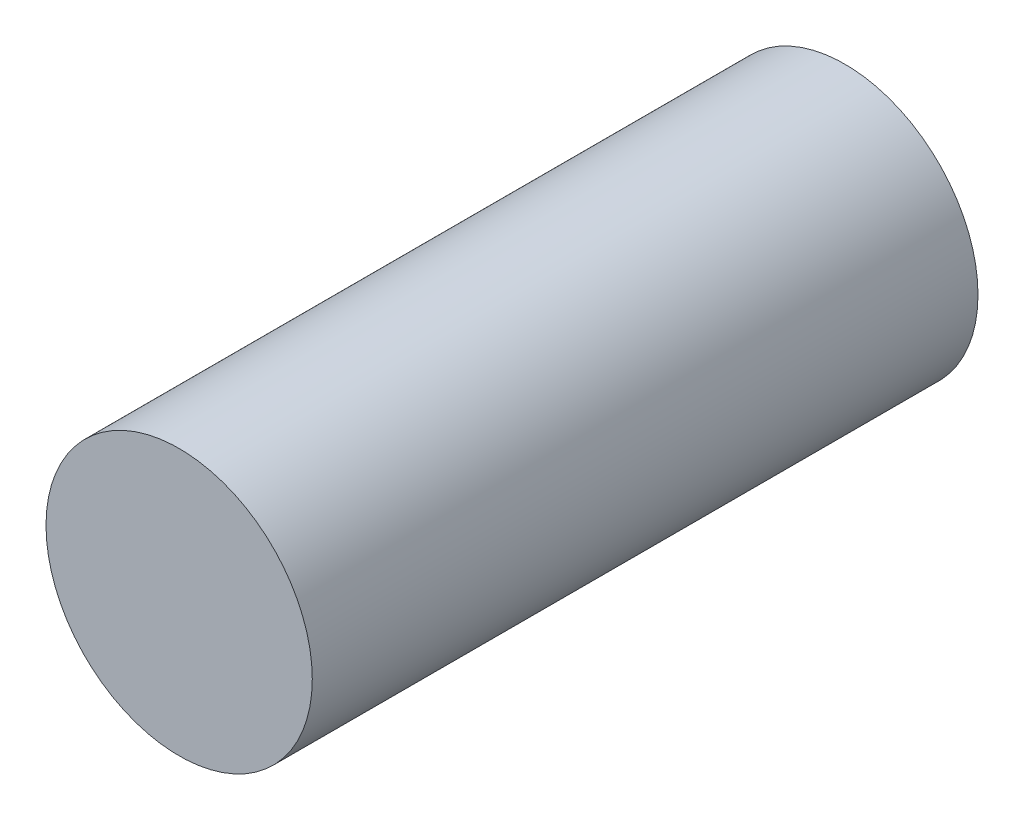
from build123d import *

# Parameters (mm, degrees)
TOPPING_KAT3_KAPAK_PIMI_D8_1_START = -40
SKETCH1_R                          = 4
TOPPING_KAT3_KAPAK_PIMI_D8_1_DEPTH = 20


with BuildPart() as part:
    # Sketch1 → TOPPING_kat3_kapak_pimi_D8_1 (new body)
    with BuildSketch(Plane.XY.offset(TOPPING_KAT3_KAPAK_PIMI_D8_1_START)):
        with Locations((300, 924)):
            Circle(SKETCH1_R)
    extrude(amount=-TOPPING_KAT3_KAPAK_PIMI_D8_1_DEPTH)


solid = part.part
